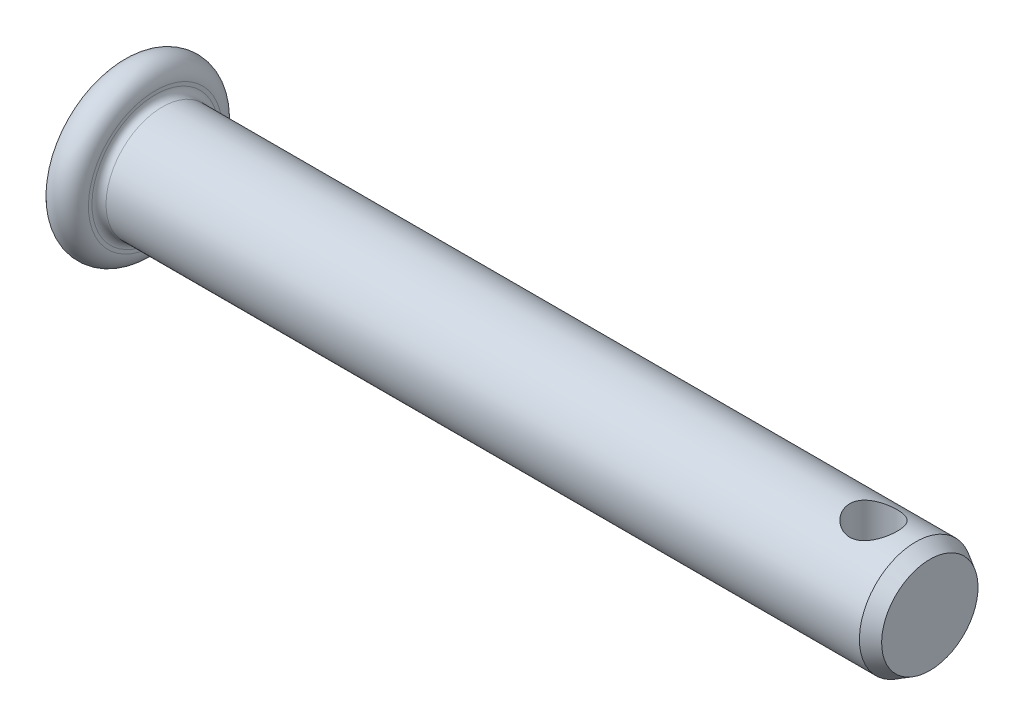
from build123d import *

# Parameters (mm, degrees)
CHAMFER1_R      = 0.5
HOLE_DEPTH      = 59.122715029
HOLE_DEPTH_BACK = 59.122715029
SKETCH2_R       = 1.69


with BuildPart() as part:
    # Sketch1 → BaseBody (revolve)
    with BuildSketch(Plane.XY, mode=Mode.PRIVATE) as basebody_sk:
        with BuildLine():
            Line((57.5, 0), (0, 0))
            Line((0, 0), (0, 4.75))
            ThreePointArc((0, 4.75), (1.25, 6), (2.5, 4.75))
            Line((2.5, 4.75), (2.5, 4))
            Line((2.5, 4), (56.5, 4))
            Line((56.5, 4), (57.5, 3.422649731))
            Line((57.5, 3.422649731), (57.5, 0))
        make_face()
    revolve(basebody_sk.sketch.rotate(Axis((-19.830028721, 0, 0), (1, 0, 0)), 180), axis=Axis((-19.830028721, 0, 0), (1, 0, 0)))

    # Chamfer1
    chamfer1_edges = [part.edges().sort_by_distance(p)[0] for p in [
        (2.5, 4, 0),
    ]]
    fillet(chamfer1_edges, radius=CHAMFER1_R)

    # Sketch2 → Hole (cut, two sides: drawn at the far end of the back side and taken through both)
    with BuildSketch(Plane(origin=(0, 0, 0), x_dir=(1, 0, 0), z_dir=(0, 1, 0)).offset(-HOLE_DEPTH_BACK)):
        with Locations(Location((53.5, 0, 0), (0, 0, 270))):
            Circle(SKETCH2_R)
    extrude(amount=HOLE_DEPTH + HOLE_DEPTH_BACK, mode=Mode.SUBTRACT)


solid = part.part
